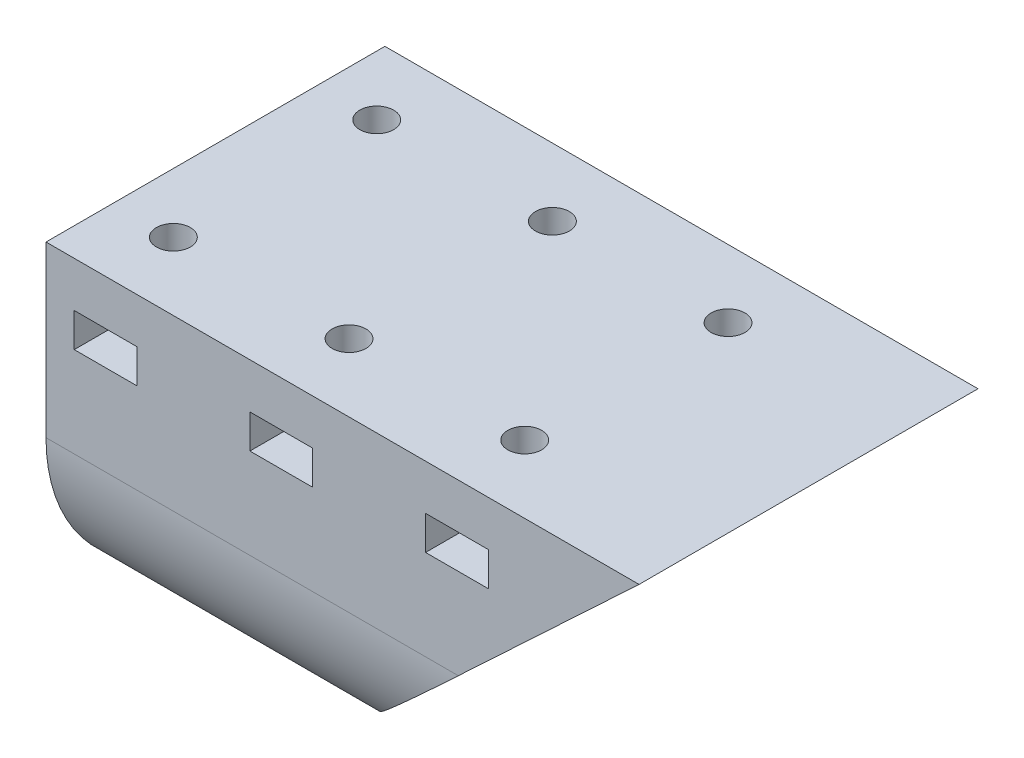
from build123d import *

# Parameters (mm, degrees)
SKETCH1_R                = 15
SKETCH1_R_2              = 12.85
BOSS_EXTRUDE1_DEPTH      = 2.5
BOSS_EXTRUDE2_DEPTH      = 50
BOSS_EXTRUDE2_DEPTH_BACK = 2.5
SKETCH2_R                = 12.8
CUT_EXTRUDE1_DEPTH       = 57.623758265
CUT_EXTRUDE1_DEPTH_BACK  = 57.623758265
SKETCH4_W                = 5.55
SKETCH4_H                = 3
CUT_EXTRUDE2_DEPTH       = 9
SKETCH5_R                = 1.5
CUT_EXTRUDE3_DEPTH       = 7


with BuildPart() as part:
    # Sketch1 → Boss-Extrude1 (new body)
    with BuildSketch(Plane(origin=(0, 0, 0), x_dir=(0, 0, -1), z_dir=(1, 0, 0))):
        Circle(SKETCH1_R)
        Circle(SKETCH1_R_2, mode=Mode.SUBTRACT)
    extrude(amount=BOSS_EXTRUDE1_DEPTH)

    # Sketch2 → Boss-Extrude2 (add, two sides: drawn at the far end of the back side and taken through both)
    with BuildSketch(Plane(origin=(2.5, 0, 0), x_dir=(0, 0, -1), z_dir=(1, 0, 0)).offset(-BOSS_EXTRUDE2_DEPTH_BACK)):
        with BuildLine():
            Line((-15, 15), (15, 15))
            Line((15, 15), (15, 0))
            ThreePointArc((15, 0), (0, -15), (-15, 0))
            Line((-15, 0), (-15, 15))
        make_face()
        Circle(SKETCH2_R, mode=Mode.SUBTRACT)
    extrude(amount=BOSS_EXTRUDE2_DEPTH + BOSS_EXTRUDE2_DEPTH_BACK)

    # Sketch3 → Cut-Extrude1 (cut, two sides: drawn at the far end of the back side and taken through both)
    with BuildSketch(Plane.XY.offset(-CUT_EXTRUDE1_DEPTH_BACK)):
        Polygon((52.5, 15), (20.5, -15), (52.5, -15), align=None)
    extrude(amount=CUT_EXTRUDE1_DEPTH + CUT_EXTRUDE1_DEPTH_BACK, mode=Mode.SUBTRACT)

    # Sketch4 → Cut-Extrude2 (cut)
    with BuildSketch(Plane.XY.offset(15)):
        with Locations((5.275, 9.5)):
            Rectangle(SKETCH4_W, SKETCH4_H)
        with Locations((20.825, 9.5)):
            Rectangle(SKETCH4_W, SKETCH4_H)
        with Locations((36.375, 9.5)):
            Rectangle(SKETCH4_W, SKETCH4_H)
    cut_extrude2 = extrude(amount=-CUT_EXTRUDE2_DEPTH, mode=Mode.SUBTRACT)

    # Sketch5 → Cut-Extrude3 (cut)
    with BuildSketch(Plane(origin=(0, 15, 0), x_dir=(1, 0, 0), z_dir=(0, 1, 0))):
        with Locations(Location((5.275, -9, 0), (0, 0, 270))):
            Circle(SKETCH5_R)
        with Locations(Location((20.825, -9, 0), (0, 0, 270))):
            Circle(SKETCH5_R)
        with Locations(Location((36.375, -9, 0), (0, 0, 270))):
            Circle(SKETCH5_R)
    cut_extrude3 = extrude(amount=-CUT_EXTRUDE3_DEPTH, mode=Mode.SUBTRACT)

    # Mirror1: Cut-Extrude2, Cut-Extrude3 across plane
    add(cut_extrude2.mirror(Plane.XY), mode=Mode.SUBTRACT)
    add(cut_extrude3.mirror(Plane.XY), mode=Mode.SUBTRACT)


solid = part.part
